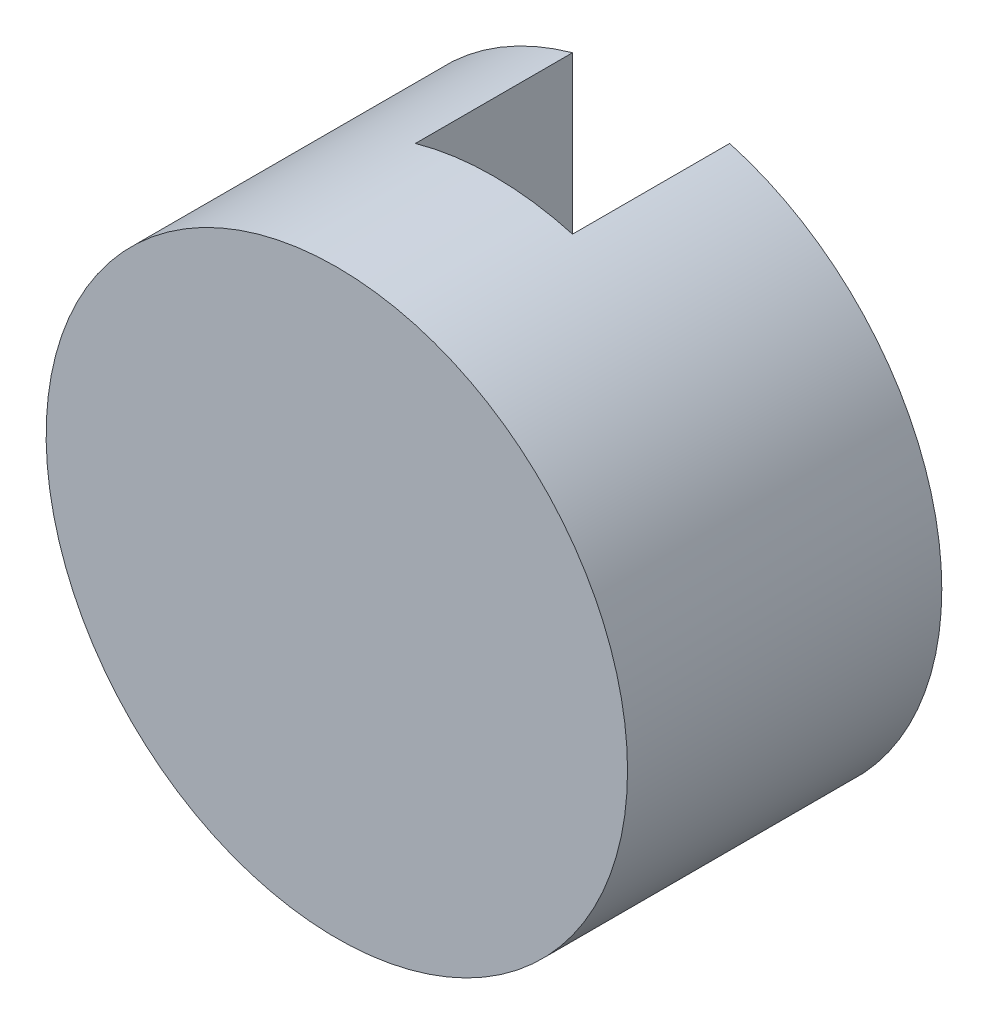
from build123d import *

# Parameters (mm, degrees)
ESBO_O1_R                = 1.85
RESSALTO_EXTRUS_O1_DEPTH = 2
ESBO_O2_W                = 1
ESBO_O2_H                = 5.130124138
CORTE_EXTRUS_O1_DEPTH    = 1


with BuildPart() as part:
    # Esboço1 → Ressalto-extrusão1 (new body)
    with BuildSketch(Plane.XY):
        with Locations((-36.819348603, 12.646095076)):
            Circle(ESBO_O1_R)
    extrude(amount=RESSALTO_EXTRUS_O1_DEPTH)

    # Esboço2 → Corte-extrusão1 (cut)
    with BuildSketch(Plane(origin=(0, 0, 0), x_dir=(-1, 0, 0), z_dir=(0, 0, -1))):
        with Locations((36.819348603, 12.69871976)):
            Rectangle(ESBO_O2_W, ESBO_O2_H)
    extrude(amount=-CORTE_EXTRUS_O1_DEPTH, mode=Mode.SUBTRACT)


solid = part.part
